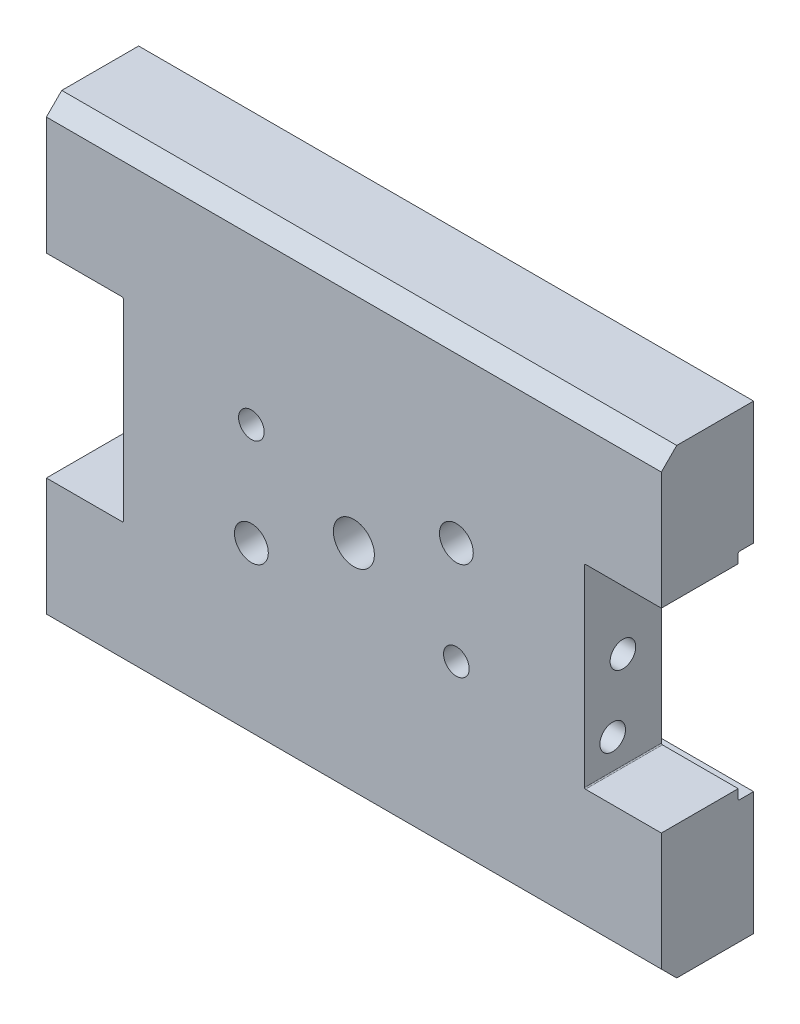
from build123d import *

# Parameters (mm, degrees)
ESTRUSIONE_ESTRUSIONE1_DEPTH                         = 18
TAGLIO_ESTRUSIONE1_DEPTH                             = 78.129760793
TAGLIO_ESTRUSIONE1_DEPTH_BACK                        = 78.129760793
SCHIZZO2_W                                           = 3
SCHIZZO2_H                                           = 42
FORO_8_0_8_1_D                                       = 8
FORO_5_0_5_2_D                                       = 5
FORO_LAMATO_PER_VITE_M6_A_TESTA_CILINDRI_D           = 6.6
FORO_LAMATO_PER_VITE_M6_A_TESTA_CILINDRI_CBORE_D     = 11
FORO_LAMATO_PER_VITE_M6_A_TESTA_CILINDRI_CBORE_DEPTH = 6.4
FORO_5_0_5_3_AT_2_COUNT                              = 2
FORO_5_0_5_3_AT_2_PITCH                              = 26.305892876
SMUSSO1_SIZE                                         = 3
RACCORDO1_R                                          = 0.2


with BuildPart() as part:
    # Schizzo1 → Estrusione-Estrusione1 (new body)
    with BuildSketch(Plane.XY):
        Polygon((-60, 45), (60, 45), (60, 19), (45, 19), (45, -19), (60, -19), (60, -45), (-60, -45), (-60, -19), (-45, -19), (-45, 19), (-60, 19), align=None)
    extrude(amount=ESTRUSIONE_ESTRUSIONE1_DEPTH)

    # Schizzo2 → Taglio-Estrusione1 (cut, two sides: drawn at the far end of the back side and taken through both)
    with BuildSketch(Plane(origin=(0, 0, 0), x_dir=(0, 0, -1), z_dir=(1, 0, 0)).offset(-TAGLIO_ESTRUSIONE1_DEPTH_BACK)):
        with Locations((-1.5, 0)):
            Rectangle(SCHIZZO2_W, SCHIZZO2_H)
    extrude(amount=TAGLIO_ESTRUSIONE1_DEPTH + TAGLIO_ESTRUSIONE1_DEPTH_BACK, mode=Mode.SUBTRACT)

    # Schizzo4 → Foro filettato M6-1 (revolve, cut)
    with BuildSketch(Plane(origin=(45, 0, 10.5), x_dir=(0, 0, -1), z_dir=(0, 1, 0))):
        Polygon((0, 0), (0, 21.502151548), (2.5, 20), (2.5, 0), align=None)
    foro_filettato_m6_1 = revolve(axis=Axis((51.35, 0, 10.5), (-1, 0, 0)), mode=Mode.SUBTRACT)

    # Foro Ø8.0 (8)-1 (through all)
    with Locations(Plane.XY.offset(18)):
        with Locations((0, 0)):
            Hole(FORO_8_0_8_1_D / 2)

    # Foro Ø5.0 (5)-2 (through all)
    with Locations(Plane.XY.offset(18)):
        with Locations((20, -10), (-20, 10)):
            Hole(FORO_5_0_5_2_D / 2)

    # Foro lamato per Vite M6 a testa cilindrica-1 (through all)
    with Locations(Plane(origin=(0, 0, 3), x_dir=(-1, 0, 0), z_dir=(0, 0, -1))):
        with Locations((-20, 10), (20, -10)):
            CounterBoreHole(FORO_LAMATO_PER_VITE_M6_A_TESTA_CILINDRI_D / 2, FORO_LAMATO_PER_VITE_M6_A_TESTA_CILINDRI_CBORE_D / 2, FORO_LAMATO_PER_VITE_M6_A_TESTA_CILINDRI_CBORE_DEPTH)

    # Schizzo14 → Foro Ø5.0 (5)-3 (revolve, cut)
    with BuildSketch(Plane(origin=(45, -13, 12.5), x_dir=(0, 0, -1), z_dir=(0, 1, 0))):
        Polygon((0, 0), (0, 11.502151548), (2.5, 10), (2.5, 0), align=None)
    foro_5_0_5_3 = revolve(axis=Axis((51.35, -13, 12.5), (-1, 0, 0)), mode=Mode.SUBTRACT)

    # Foro Ø5.0 (5)-3 at 2: Foro Ø5.0 (5)-3 ×2
    with Locations(*[Vector(0, 0.9883716976506173, -0.15205718425394077) * (i * FORO_5_0_5_3_AT_2_PITCH) for i in range(1, FORO_5_0_5_3_AT_2_COUNT)]):
        add(foro_5_0_5_3, mode=Mode.SUBTRACT)

    # Smusso1
    smusso1_edges = [part.edges().sort_by_distance(p)[0] for p in [
        (0, 45, 18),
        (0, -45, 18),
    ]]
    chamfer(smusso1_edges, length=SMUSSO1_SIZE)

    # Raccordo1
    raccordo1_edges = [part.edges().sort_by_distance(p)[0] for p in [
        (45, -19, 10.5),
        (45, 19, 10.5),
        (-45, 19, 10.5),
        (-45, -19, 10.5),
        (0, -21, 3),
        (0, 21, 3),
    ]]
    fillet(raccordo1_edges, radius=RACCORDO1_R)

    # Specchia1: Foro filettato M6-1, Foro Ø5.0 (5)-3 across plane
    add(foro_filettato_m6_1.mirror(Plane(origin=(0, 0, 0), x_dir=(0, 0, 1), z_dir=(1, 0, 0))), mode=Mode.SUBTRACT)
    add(foro_5_0_5_3.mirror(Plane(origin=(0, 0, 0), x_dir=(0, 0, 1), z_dir=(1, 0, 0))), mode=Mode.SUBTRACT)

    # Specchia1 copy 1 sketch → Specchia1 copy 1 (revolve, cut)
    with BuildSketch(Plane(origin=(-45, 13, 8.5), x_dir=(0, 0, -1), z_dir=(0, 1, 0))):
        Polygon((0, 0), (0, -11.502151548), (2.5, -10), (2.5, 0), align=None)
    revolve(axis=Axis((-51.35, 13, 8.5), (-1, 0, 0)), mode=Mode.SUBTRACT)


solid = part.part
